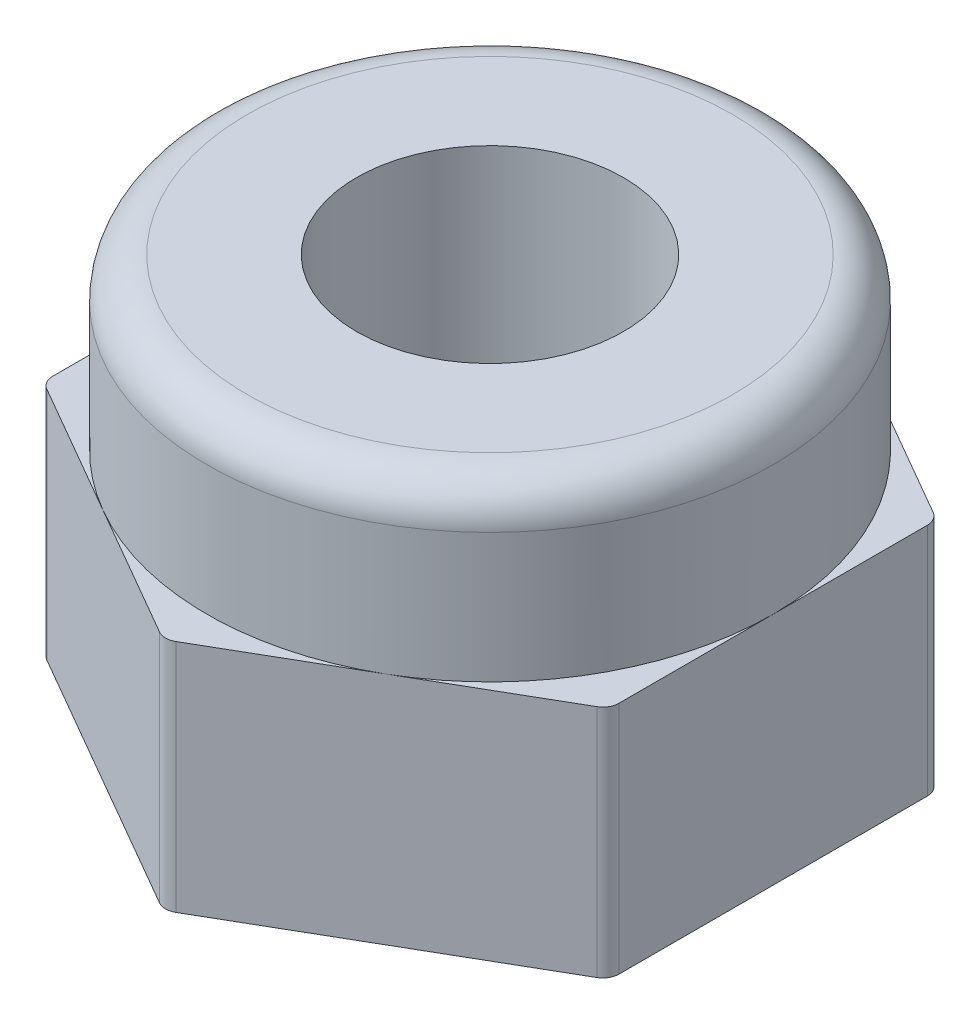
from build123d import *

# Parameters (mm, degrees)
EXTRUDE_1_DEPTH    = 2.9
SKETCH_2_R         = 3.5
EXTRUDE_2_DEPTH    = 5
FILLET_1_R         = 0.5
FILLET_2_R         = 0.2
HOLE_WIZARD_M4_1_D = 3.3


with BuildPart() as part:
    # 草图1 → 凸台-拉伸1 (new body)
    with BuildSketch(Plane(origin=(0, 0, 0), x_dir=(1, 0, 0), z_dir=(0, 1, 0))):
        Polygon((0, 4.041451884), (-3.5, 2.020725942), (-3.5, -2.020725942), (0, -4.041451884), (3.5, -2.020725942), (3.5, 2.020725942), align=None)
    extrude(amount=EXTRUDE_1_DEPTH)

    # 草图2 → 凸台-拉伸2 (add)
    with BuildSketch(Plane.XZ):
        with Locations(Location((0, 0, 0), (0, 0, 270))):
            Circle(SKETCH_2_R)
    extrude(amount=-EXTRUDE_2_DEPTH)

    # 圆角1
    fillet_1_edges = [part.edges().sort_by_distance(p)[0] for p in [
        (0, 5, 3.5),
    ]]
    fillet(fillet_1_edges, radius=FILLET_1_R)

    # 圆角2
    fillet_2_edges = [part.edges().sort_by_distance(p)[0] for p in [
        (3.5, 1.45, -2.020725942),
        (3.5, 1.45, 2.020725942),
        (0, 1.45, 4.041451884),
        (-3.5, 1.45, 2.020725942),
        (-3.5, 1.45, -2.020725942),
        (0, 1.45, -4.041451884),
    ]]
    fillet(fillet_2_edges, radius=FILLET_2_R)

    # M4 螺纹孔1 (through all)
    with Locations(Plane(origin=(0, 0, 0), x_dir=(-1, 0, 0), z_dir=(0, -1, 0))):
        with Locations((0, 0)):
            Hole(HOLE_WIZARD_M4_1_D / 2)


solid = part.part
